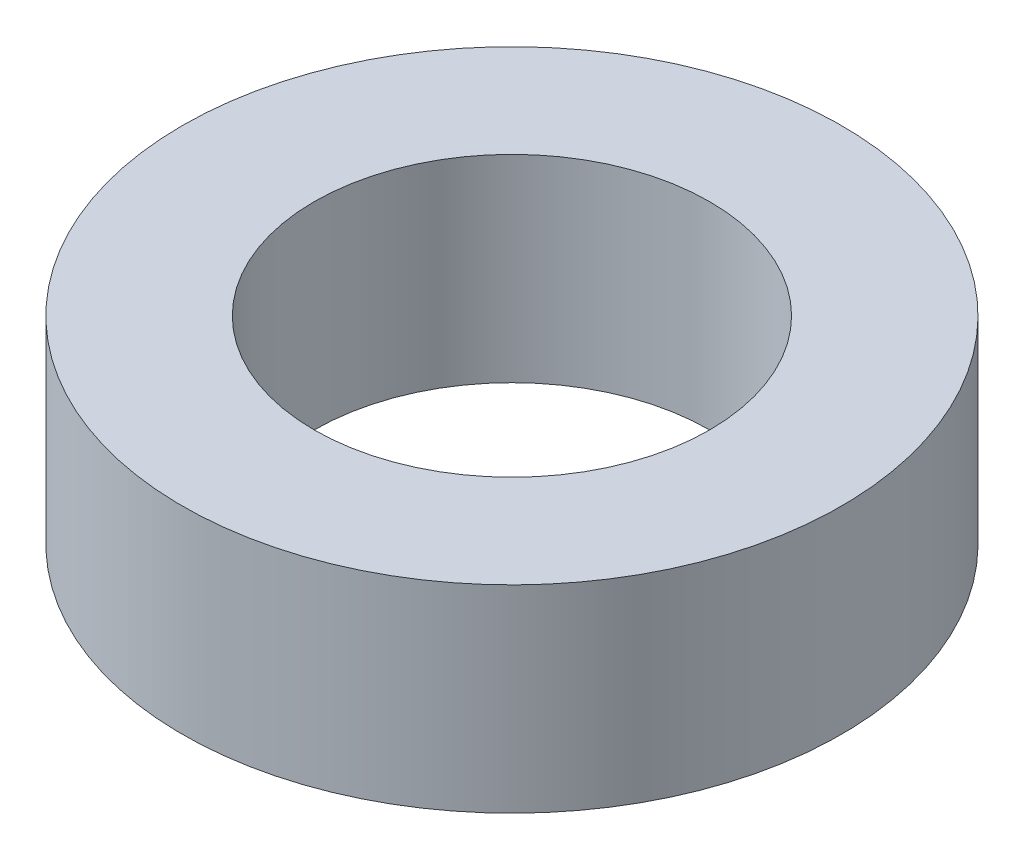
from build123d import *

# Parameters (mm, degrees)
SKETCH_3_W = 10
SKETCH_3_H = 15


with BuildPart() as part:
    # 草图3 → 旋转1 (revolve)
    with BuildSketch(Plane.XY):
        with Locations((-20, 0)):
            Rectangle(SKETCH_3_W, SKETCH_3_H)
    revolve(axis=Axis((0, 15.672727273, 0), (0, -1, 0)))


solid = part.part
